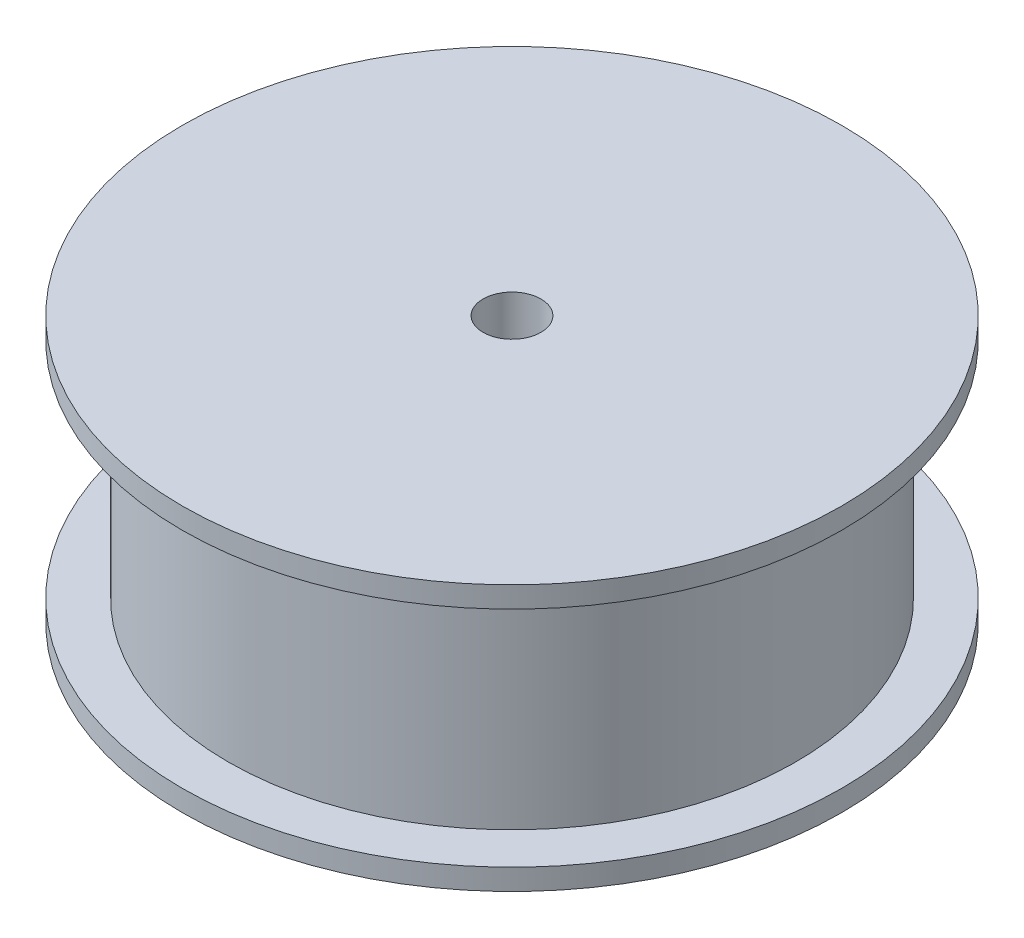
from build123d import *

# Parameters (mm, degrees)
SKETCH1_R           = 18
BOSS_EXTRUDE1_DEPTH = 1.15
SKETCH2_R           = 15.499999988
BOSS_EXTRUDE2_DEPTH = 12.2
SKETCH3_R           = 18
BOSS_EXTRUDE3_DEPTH = 1.15
SKETCH4_R           = 1.58
CUT_EXTRUDE1_DEPTH  = 14.5


with BuildPart() as part:
    # Sketch1 → Boss-Extrude1 (new body)
    with BuildSketch(Plane(origin=(0, 0, 0), x_dir=(1, 0, 0), z_dir=(0, 1, 0))):
        with Locations(Location((0, 0, 0), (0, 0, 270))):
            Circle(SKETCH1_R)
    extrude(amount=BOSS_EXTRUDE1_DEPTH)

    # Sketch2 → Boss-Extrude2 (add)
    with BuildSketch(Plane(origin=(0, 1.15, 0), x_dir=(1, 0, 0), z_dir=(0, 1, 0))):
        with Locations(Location((0, 0, 0), (0, 0, 270))):
            Circle(SKETCH2_R)
    extrude(amount=BOSS_EXTRUDE2_DEPTH)

    # Sketch3 → Boss-Extrude3 (add)
    with BuildSketch(Plane(origin=(0, 13.35, 0), x_dir=(1, 0, 0), z_dir=(0, 1, 0))):
        with Locations(Location((0, 0, 0), (0, 0, 270))):
            Circle(SKETCH3_R)
    extrude(amount=BOSS_EXTRUDE3_DEPTH)

    # Sketch4 → Cut-Extrude1 (cut)
    with BuildSketch(Plane(origin=(0, 14.5, 0), x_dir=(1, 0, 0), z_dir=(0, 1, 0))):
        with Locations(Location((0, 0, 0), (0, 0, 270))):
            Circle(SKETCH4_R)
    extrude(amount=-CUT_EXTRUDE1_DEPTH, mode=Mode.SUBTRACT)


solid = part.part
